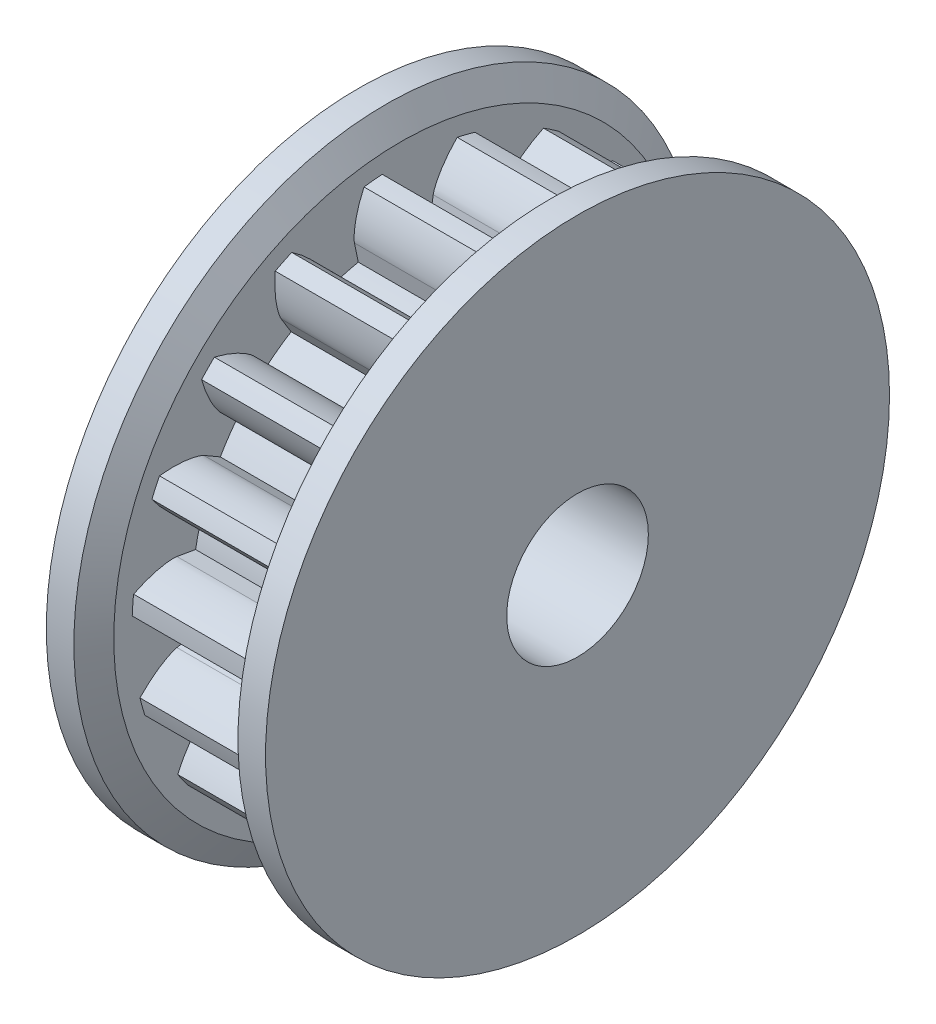
from build123d import *

# Parameters (mm, degrees)
SKETCH1_R                   = 7.957747155
BOSS_EXTRUDE1_DEPTH         = 4
CUT_EXTRUDE1_DEPTH          = 12.943679481
CIRPATTERN6_COUNT           = 18
CIRPATTERN6_COPY_1_DEPTH    = 12.943679481
CIRPATTERN6_COPY_2_DEPTH    = 12.943679481
CIRPATTERN6_COPY_3_DEPTH    = 12.943679481
CIRPATTERN6_COPY_4_DEPTH    = 12.943679481
CIRPATTERN6_COPY_5_DEPTH    = 12.943679481
CIRPATTERN6_COPY_6_DEPTH    = 12.943679481
CIRPATTERN6_COPY_7_DEPTH    = 12.943679481
CIRPATTERN6_COPY_8_DEPTH    = 12.943679481
CIRPATTERN6_COPY_9_DEPTH    = 12.943679481
CIRPATTERN6_COPY_10_DEPTH   = 12.943679481
CIRPATTERN6_COPY_11_DEPTH   = 12.943679481
CIRPATTERN6_COPY_12_DEPTH   = 12.943679481
CIRPATTERN6_COPY_13_DEPTH   = 12.943679481
CIRPATTERN6_COPY_14_DEPTH   = 12.943679481
CIRPATTERN6_COPY_15_DEPTH   = 12.943679481
CIRPATTERN6_COPY_16_DEPTH   = 12.943679481
CIRPATTERN6_COPY_17_DEPTH   = 12.943679481
TAP_DRILL_FOR_M5X0_8_TAP1_D = 4.2


with BuildPart() as part:
    # Sketch1 → Boss-Extrude1 (new body)
    with BuildSketch(Plane.YZ):
        with Locations(Location((0, 0, 0), (0, 0, 270))):
            Circle(SKETCH1_R)
    extrude(amount=BOSS_EXTRUDE1_DEPTH)

    # Sketch3 → Cut-Extrude1 (cut, through all)
    with BuildSketch(Plane.YZ.offset(4)):
        with BuildLine():
            Line((7.143229636, -0.51780265), (6.712440178, -0.486575329))
            Line((6.712440178, -0.486575329), (6.151114409, -0.445885615))
            ThreePointArc((6.151114409, -0.445885615), (6.163217815, -0.223088811), (6.167254045, 0))
            Line((6.167254045, 0), (6.730052651, 0))
            add(Edge.make_bspline(
                [(6.730052651, 0), (6.735028201, 0.000105291), (6.748972525, 0.000726446), (6.77527671, 0.003186858), (6.818021267, 0.009021853), (6.872154257, 0.019121147), (6.9416096, 0.03521433), (7.022648863, 0.058053596), (7.110734403, 0.087182224), (7.205358415, 0.123170438), (7.298569457, 0.162835205), (7.390333265, 0.205857711), (7.480573489, 0.251804665), (7.588384326, 0.311053922), (7.715499791, 0.387065097), (7.860631857, 0.482971281), (8.020934099, 0.599954491), (8.179305123, 0.727671007), (8.330895439, 0.860239842), (8.478803786, 1.001795462), (8.618157696, 1.144139991), (8.757082001, 1.299382167), (8.88238288, 1.446480246), (9.015933814, 1.619048793), (9.121746557, 1.760623063), (9.225109986, 1.913051571), (9.274529275, 1.988136308), (9.299406998, 2.026881066)],
                knots=[0, 0, 0, 0, 0, 0.005376748, 0.015083688, 0.02853182, 0.046610139, 0.064854849, 0.092110525, 0.119476175, 0.146842495, 0.174208853, 0.201574955, 0.228941013, 0.256307345, 0.307035032, 0.361767351, 0.41649966, 0.471231936, 0.525964281, 0.580696615, 0.635428982, 0.690161387, 0.744893688, 0.799626083, 0.854358408, 0.909090916, 0.909090916, 0.909090916, 0.909090916, 0.909090916], degree=4))
            Line((9.299406998, 2.026881066), (9.299406998, -0.674100909))
            Line((9.299406998, -0.674100909), (7.143229636, -0.51780265))
        make_face()
    cut_extrude1 = extrude(amount=-CUT_EXTRUDE1_DEPTH, mode=Mode.SUBTRACT)

    # Mirror1: Cut-Extrude1 across plane
    add(cut_extrude1.mirror(Plane(origin=(0, 7.143229636, -0.51780265), x_dir=(1, 0, 0), z_dir=(0, -0.07229888895007923, -0.9973830110126121))), mode=Mode.SUBTRACT)

    # CirPattern6: Cut-Extrude1 ×18 about axis
    cirpattern6_axis = Axis((4, 0, 0), (-1, 0, 0))
    for i in range(1, CIRPATTERN6_COUNT):
        add(cut_extrude1.rotate(cirpattern6_axis, i * 360 / CIRPATTERN6_COUNT), mode=Mode.SUBTRACT)

    # CirPattern6 copy 1 sketch → CirPattern6 copy 1 (cut, through all)
    with BuildSketch(Plane(origin=(4, 0, 0), x_dir=(0, 0.880542902433561, -0.4739664513168419), z_dir=(1, 0, 0))):
        with BuildLine():
            Line((7.143229636, 0.51780265), (6.712440178, 0.486575329))
            Line((6.712440178, 0.486575329), (6.151114409, 0.445885615))
            ThreePointArc((6.151114409, 0.445885615), (6.163217815, 0.223088811), (6.167254045, 0))
            Line((6.167254045, 0), (6.730052651, 0))
            add(Edge.make_bspline(
                [(6.730052651, 0), (6.735028201, -0.000105291), (6.748972525, -0.000726446), (6.77527671, -0.003186858), (6.818021267, -0.009021853), (6.872154257, -0.019121147), (6.9416096, -0.03521433), (7.022648863, -0.058053596), (7.110734403, -0.087182224), (7.205358415, -0.123170438), (7.298569457, -0.162835205), (7.390333265, -0.205857711), (7.480573489, -0.251804665), (7.588384326, -0.311053922), (7.715499791, -0.387065097), (7.860631857, -0.482971281), (8.020934099, -0.599954491), (8.179305123, -0.727671007), (8.330895439, -0.860239842), (8.478803786, -1.001795462), (8.618157696, -1.144139991), (8.757082001, -1.299382167), (8.88238288, -1.446480246), (9.015933814, -1.619048793), (9.121746557, -1.760623063), (9.225109986, -1.913051571), (9.274529275, -1.988136308), (9.299406998, -2.026881066)],
                knots=[0, 0, 0, 0, 0, 0.005376748, 0.015083688, 0.02853182, 0.046610139, 0.064854849, 0.092110525, 0.119476175, 0.146842495, 0.174208853, 0.201574955, 0.228941013, 0.256307345, 0.307035032, 0.361767351, 0.41649966, 0.471231936, 0.525964281, 0.580696615, 0.635428982, 0.690161387, 0.744893688, 0.799626083, 0.854358408, 0.909090916, 0.909090916, 0.909090916, 0.909090916, 0.909090916], degree=4))
            Line((9.299406998, -2.026881066), (9.299406998, 0.674100909))
            Line((9.299406998, 0.674100909), (7.143229636, 0.51780265))
        make_face()
    extrude(amount=-CIRPATTERN6_COPY_1_DEPTH, mode=Mode.SUBTRACT)

    # CirPattern6 copy 2 sketch → CirPattern6 copy 2 (cut, through all)
    with BuildSketch(Plane(origin=(4, 0, 0), x_dir=(0, 0.6653335940912785, -0.7465461864972467), z_dir=(1, 0, 0))):
        with BuildLine():
            Line((7.143229636, 0.51780265), (6.712440178, 0.486575329))
            Line((6.712440178, 0.486575329), (6.151114409, 0.445885615))
            ThreePointArc((6.151114409, 0.445885615), (6.163217815, 0.223088811), (6.167254045, 0))
            Line((6.167254045, 0), (6.730052651, 0))
            add(Edge.make_bspline(
                [(6.730052651, 0), (6.735028201, -0.000105291), (6.748972525, -0.000726446), (6.77527671, -0.003186858), (6.818021267, -0.009021853), (6.872154257, -0.019121147), (6.9416096, -0.03521433), (7.022648863, -0.058053596), (7.110734403, -0.087182224), (7.205358415, -0.123170438), (7.298569457, -0.162835205), (7.390333265, -0.205857711), (7.480573489, -0.251804665), (7.588384326, -0.311053922), (7.715499791, -0.387065097), (7.860631857, -0.482971281), (8.020934099, -0.599954491), (8.179305123, -0.727671007), (8.330895439, -0.860239842), (8.478803786, -1.001795462), (8.618157696, -1.144139991), (8.757082001, -1.299382167), (8.88238288, -1.446480246), (9.015933814, -1.619048793), (9.121746557, -1.760623063), (9.225109986, -1.913051571), (9.274529275, -1.988136308), (9.299406998, -2.026881066)],
                knots=[0, 0, 0, 0, 0, 0.005376748, 0.015083688, 0.02853182, 0.046610139, 0.064854849, 0.092110525, 0.119476175, 0.146842495, 0.174208853, 0.201574955, 0.228941013, 0.256307345, 0.307035032, 0.361767351, 0.41649966, 0.471231936, 0.525964281, 0.580696615, 0.635428982, 0.690161387, 0.744893688, 0.799626083, 0.854358408, 0.909090916, 0.909090916, 0.909090916, 0.909090916, 0.909090916], degree=4))
            Line((9.299406998, -2.026881066), (9.299406998, 0.674100909))
            Line((9.299406998, 0.674100909), (7.143229636, 0.51780265))
        make_face()
    extrude(amount=-CIRPATTERN6_COPY_2_DEPTH, mode=Mode.SUBTRACT)

    # CirPattern6 copy 3 sketch → CirPattern6 copy 3 (cut, through all)
    with BuildSketch(Plane(origin=(4, 0, 0), x_dir=(0, 0.3698752350235216, -0.9290814337378046), z_dir=(1, 0, 0))):
        with BuildLine():
            Line((7.143229636, 0.51780265), (6.712440178, 0.486575329))
            Line((6.712440178, 0.486575329), (6.151114409, 0.445885615))
            ThreePointArc((6.151114409, 0.445885615), (6.163217815, 0.223088811), (6.167254045, 0))
            Line((6.167254045, 0), (6.730052651, 0))
            add(Edge.make_bspline(
                [(6.730052651, 0), (6.735028201, -0.000105291), (6.748972525, -0.000726446), (6.77527671, -0.003186858), (6.818021267, -0.009021853), (6.872154257, -0.019121147), (6.9416096, -0.03521433), (7.022648863, -0.058053596), (7.110734403, -0.087182224), (7.205358415, -0.123170438), (7.298569457, -0.162835205), (7.390333265, -0.205857711), (7.480573489, -0.251804665), (7.588384326, -0.311053922), (7.715499791, -0.387065097), (7.860631857, -0.482971281), (8.020934099, -0.599954491), (8.179305123, -0.727671007), (8.330895439, -0.860239842), (8.478803786, -1.001795462), (8.618157696, -1.144139991), (8.757082001, -1.299382167), (8.88238288, -1.446480246), (9.015933814, -1.619048793), (9.121746557, -1.760623063), (9.225109986, -1.913051571), (9.274529275, -1.988136308), (9.299406998, -2.026881066)],
                knots=[0, 0, 0, 0, 0, 0.005376748, 0.015083688, 0.02853182, 0.046610139, 0.064854849, 0.092110525, 0.119476175, 0.146842495, 0.174208853, 0.201574955, 0.228941013, 0.256307345, 0.307035032, 0.361767351, 0.41649966, 0.471231936, 0.525964281, 0.580696615, 0.635428982, 0.690161387, 0.744893688, 0.799626083, 0.854358408, 0.909090916, 0.909090916, 0.909090916, 0.909090916, 0.909090916], degree=4))
            Line((9.299406998, -2.026881066), (9.299406998, 0.674100909))
            Line((9.299406998, 0.674100909), (7.143229636, 0.51780265))
        make_face()
    extrude(amount=-CIRPATTERN6_COPY_3_DEPTH, mode=Mode.SUBTRACT)

    # CirPattern6 copy 4 sketch → CirPattern6 copy 4 (cut, through all)
    with BuildSketch(Plane(origin=(4, 0, 0), x_dir=(0, 0.029804463834835065, -0.9995557482879671), z_dir=(1, 0, 0))):
        with BuildLine():
            Line((7.143229636, 0.51780265), (6.712440178, 0.486575329))
            Line((6.712440178, 0.486575329), (6.151114409, 0.445885615))
            ThreePointArc((6.151114409, 0.445885615), (6.163217815, 0.223088811), (6.167254045, 0))
            Line((6.167254045, 0), (6.730052651, 0))
            add(Edge.make_bspline(
                [(6.730052651, 0), (6.735028201, -0.000105291), (6.748972525, -0.000726446), (6.77527671, -0.003186858), (6.818021267, -0.009021853), (6.872154257, -0.019121147), (6.9416096, -0.03521433), (7.022648863, -0.058053596), (7.110734403, -0.087182224), (7.205358415, -0.123170438), (7.298569457, -0.162835205), (7.390333265, -0.205857711), (7.480573489, -0.251804665), (7.588384326, -0.311053922), (7.715499791, -0.387065097), (7.860631857, -0.482971281), (8.020934099, -0.599954491), (8.179305123, -0.727671007), (8.330895439, -0.860239842), (8.478803786, -1.001795462), (8.618157696, -1.144139991), (8.757082001, -1.299382167), (8.88238288, -1.446480246), (9.015933814, -1.619048793), (9.121746557, -1.760623063), (9.225109986, -1.913051571), (9.274529275, -1.988136308), (9.299406998, -2.026881066)],
                knots=[0, 0, 0, 0, 0, 0.005376748, 0.015083688, 0.02853182, 0.046610139, 0.064854849, 0.092110525, 0.119476175, 0.146842495, 0.174208853, 0.201574955, 0.228941013, 0.256307345, 0.307035032, 0.361767351, 0.41649966, 0.471231936, 0.525964281, 0.580696615, 0.635428982, 0.690161387, 0.744893688, 0.799626083, 0.854358408, 0.909090916, 0.909090916, 0.909090916, 0.909090916, 0.909090916], degree=4))
            Line((9.299406998, -2.026881066), (9.299406998, 0.674100909))
            Line((9.299406998, 0.674100909), (7.143229636, 0.51780265))
        make_face()
    extrude(amount=-CIRPATTERN6_COPY_4_DEPTH, mode=Mode.SUBTRACT)

    # CirPattern6 copy 5 sketch → CirPattern6 copy 5 (cut, through all)
    with BuildSketch(Plane(origin=(4, 0, 0), x_dir=(0, -0.3138611655593716, -0.9494688877228745), z_dir=(1, 0, 0))):
        with BuildLine():
            Line((7.143229636, 0.51780265), (6.712440178, 0.486575329))
            Line((6.712440178, 0.486575329), (6.151114409, 0.445885615))
            ThreePointArc((6.151114409, 0.445885615), (6.163217815, 0.223088811), (6.167254045, 0))
            Line((6.167254045, 0), (6.730052651, 0))
            add(Edge.make_bspline(
                [(6.730052651, 0), (6.735028201, -0.000105291), (6.748972525, -0.000726446), (6.77527671, -0.003186858), (6.818021267, -0.009021853), (6.872154257, -0.019121147), (6.9416096, -0.03521433), (7.022648863, -0.058053596), (7.110734403, -0.087182224), (7.205358415, -0.123170438), (7.298569457, -0.162835205), (7.390333265, -0.205857711), (7.480573489, -0.251804665), (7.588384326, -0.311053922), (7.715499791, -0.387065097), (7.860631857, -0.482971281), (8.020934099, -0.599954491), (8.179305123, -0.727671007), (8.330895439, -0.860239842), (8.478803786, -1.001795462), (8.618157696, -1.144139991), (8.757082001, -1.299382167), (8.88238288, -1.446480246), (9.015933814, -1.619048793), (9.121746557, -1.760623063), (9.225109986, -1.913051571), (9.274529275, -1.988136308), (9.299406998, -2.026881066)],
                knots=[0, 0, 0, 0, 0, 0.005376748, 0.015083688, 0.02853182, 0.046610139, 0.064854849, 0.092110525, 0.119476175, 0.146842495, 0.174208853, 0.201574955, 0.228941013, 0.256307345, 0.307035032, 0.361767351, 0.41649966, 0.471231936, 0.525964281, 0.580696615, 0.635428982, 0.690161387, 0.744893688, 0.799626083, 0.854358408, 0.909090916, 0.909090916, 0.909090916, 0.909090916, 0.909090916], degree=4))
            Line((9.299406998, -2.026881066), (9.299406998, 0.674100909))
            Line((9.299406998, 0.674100909), (7.143229636, 0.51780265))
        make_face()
    extrude(amount=-CIRPATTERN6_COPY_5_DEPTH, mode=Mode.SUBTRACT)

    # CirPattern6 copy 6 sketch → CirPattern6 copy 6 (cut, through all)
    with BuildSketch(Plane(origin=(4, 0, 0), x_dir=(0, -0.6196705062896465, -0.7848620666300118), z_dir=(1, 0, 0))):
        with BuildLine():
            Line((7.143229636, 0.51780265), (6.712440178, 0.486575329))
            Line((6.712440178, 0.486575329), (6.151114409, 0.445885615))
            ThreePointArc((6.151114409, 0.445885615), (6.163217815, 0.223088811), (6.167254045, 0))
            Line((6.167254045, 0), (6.730052651, 0))
            add(Edge.make_bspline(
                [(6.730052651, 0), (6.735028201, -0.000105291), (6.748972525, -0.000726446), (6.77527671, -0.003186858), (6.818021267, -0.009021853), (6.872154257, -0.019121147), (6.9416096, -0.03521433), (7.022648863, -0.058053596), (7.110734403, -0.087182224), (7.205358415, -0.123170438), (7.298569457, -0.162835205), (7.390333265, -0.205857711), (7.480573489, -0.251804665), (7.588384326, -0.311053922), (7.715499791, -0.387065097), (7.860631857, -0.482971281), (8.020934099, -0.599954491), (8.179305123, -0.727671007), (8.330895439, -0.860239842), (8.478803786, -1.001795462), (8.618157696, -1.144139991), (8.757082001, -1.299382167), (8.88238288, -1.446480246), (9.015933814, -1.619048793), (9.121746557, -1.760623063), (9.225109986, -1.913051571), (9.274529275, -1.988136308), (9.299406998, -2.026881066)],
                knots=[0, 0, 0, 0, 0, 0.005376748, 0.015083688, 0.02853182, 0.046610139, 0.064854849, 0.092110525, 0.119476175, 0.146842495, 0.174208853, 0.201574955, 0.228941013, 0.256307345, 0.307035032, 0.361767351, 0.41649966, 0.471231936, 0.525964281, 0.580696615, 0.635428982, 0.690161387, 0.744893688, 0.799626083, 0.854358408, 0.909090916, 0.909090916, 0.909090916, 0.909090916, 0.909090916], degree=4))
            Line((9.299406998, -2.026881066), (9.299406998, 0.674100909))
            Line((9.299406998, 0.674100909), (7.143229636, 0.51780265))
        make_face()
    extrude(amount=-CIRPATTERN6_COPY_6_DEPTH, mode=Mode.SUBTRACT)

    # CirPattern6 copy 7 sketch → CirPattern6 copy 7 (cut, through all)
    with BuildSketch(Plane(origin=(4, 0, 0), x_dir=(0, -0.8507384385987259, -0.5255892969711254), z_dir=(1, 0, 0))):
        with BuildLine():
            Line((7.143229636, 0.51780265), (6.712440178, 0.486575329))
            Line((6.712440178, 0.486575329), (6.151114409, 0.445885615))
            ThreePointArc((6.151114409, 0.445885615), (6.163217815, 0.223088811), (6.167254045, 0))
            Line((6.167254045, 0), (6.730052651, 0))
            add(Edge.make_bspline(
                [(6.730052651, 0), (6.735028201, -0.000105291), (6.748972525, -0.000726446), (6.77527671, -0.003186858), (6.818021267, -0.009021853), (6.872154257, -0.019121147), (6.9416096, -0.03521433), (7.022648863, -0.058053596), (7.110734403, -0.087182224), (7.205358415, -0.123170438), (7.298569457, -0.162835205), (7.390333265, -0.205857711), (7.480573489, -0.251804665), (7.588384326, -0.311053922), (7.715499791, -0.387065097), (7.860631857, -0.482971281), (8.020934099, -0.599954491), (8.179305123, -0.727671007), (8.330895439, -0.860239842), (8.478803786, -1.001795462), (8.618157696, -1.144139991), (8.757082001, -1.299382167), (8.88238288, -1.446480246), (9.015933814, -1.619048793), (9.121746557, -1.760623063), (9.225109986, -1.913051571), (9.274529275, -1.988136308), (9.299406998, -2.026881066)],
                knots=[0, 0, 0, 0, 0, 0.005376748, 0.015083688, 0.02853182, 0.046610139, 0.064854849, 0.092110525, 0.119476175, 0.146842495, 0.174208853, 0.201574955, 0.228941013, 0.256307345, 0.307035032, 0.361767351, 0.41649966, 0.471231936, 0.525964281, 0.580696615, 0.635428982, 0.690161387, 0.744893688, 0.799626083, 0.854358408, 0.909090916, 0.909090916, 0.909090916, 0.909090916, 0.909090916], degree=4))
            Line((9.299406998, -2.026881066), (9.299406998, 0.674100909))
            Line((9.299406998, 0.674100909), (7.143229636, 0.51780265))
        make_face()
    extrude(amount=-CIRPATTERN6_COPY_7_DEPTH, mode=Mode.SUBTRACT)

    # CirPattern6 copy 8 sketch → CirPattern6 copy 8 (cut, through all)
    with BuildSketch(Plane(origin=(4, 0, 0), x_dir=(0, -0.9791947596506501, -0.20292270122562803), z_dir=(1, 0, 0))):
        with BuildLine():
            Line((7.143229636, 0.51780265), (6.712440178, 0.486575329))
            Line((6.712440178, 0.486575329), (6.151114409, 0.445885615))
            ThreePointArc((6.151114409, 0.445885615), (6.163217815, 0.223088811), (6.167254045, 0))
            Line((6.167254045, 0), (6.730052651, 0))
            add(Edge.make_bspline(
                [(6.730052651, 0), (6.735028201, -0.000105291), (6.748972525, -0.000726446), (6.77527671, -0.003186858), (6.818021267, -0.009021853), (6.872154257, -0.019121147), (6.9416096, -0.03521433), (7.022648863, -0.058053596), (7.110734403, -0.087182224), (7.205358415, -0.123170438), (7.298569457, -0.162835205), (7.390333265, -0.205857711), (7.480573489, -0.251804665), (7.588384326, -0.311053922), (7.715499791, -0.387065097), (7.860631857, -0.482971281), (8.020934099, -0.599954491), (8.179305123, -0.727671007), (8.330895439, -0.860239842), (8.478803786, -1.001795462), (8.618157696, -1.144139991), (8.757082001, -1.299382167), (8.88238288, -1.446480246), (9.015933814, -1.619048793), (9.121746557, -1.760623063), (9.225109986, -1.913051571), (9.274529275, -1.988136308), (9.299406998, -2.026881066)],
                knots=[0, 0, 0, 0, 0, 0.005376748, 0.015083688, 0.02853182, 0.046610139, 0.064854849, 0.092110525, 0.119476175, 0.146842495, 0.174208853, 0.201574955, 0.228941013, 0.256307345, 0.307035032, 0.361767351, 0.41649966, 0.471231936, 0.525964281, 0.580696615, 0.635428982, 0.690161387, 0.744893688, 0.799626083, 0.854358408, 0.909090916, 0.909090916, 0.909090916, 0.909090916, 0.909090916], degree=4))
            Line((9.299406998, -2.026881066), (9.299406998, 0.674100909))
            Line((9.299406998, 0.674100909), (7.143229636, 0.51780265))
        make_face()
    extrude(amount=-CIRPATTERN6_COPY_8_DEPTH, mode=Mode.SUBTRACT)

    # CirPattern6 copy 9 sketch → CirPattern6 copy 9 (cut, through all)
    with BuildSketch(Plane(origin=(4, 0, 0), x_dir=(0, -0.9895457413131682, 0.14421936710779287), z_dir=(1, 0, 0))):
        with BuildLine():
            Line((7.143229636, 0.51780265), (6.712440178, 0.486575329))
            Line((6.712440178, 0.486575329), (6.151114409, 0.445885615))
            ThreePointArc((6.151114409, 0.445885615), (6.163217815, 0.223088811), (6.167254045, 0))
            Line((6.167254045, 0), (6.730052651, 0))
            add(Edge.make_bspline(
                [(6.730052651, 0), (6.735028201, -0.000105291), (6.748972525, -0.000726446), (6.77527671, -0.003186858), (6.818021267, -0.009021853), (6.872154257, -0.019121147), (6.9416096, -0.03521433), (7.022648863, -0.058053596), (7.110734403, -0.087182224), (7.205358415, -0.123170438), (7.298569457, -0.162835205), (7.390333265, -0.205857711), (7.480573489, -0.251804665), (7.588384326, -0.311053922), (7.715499791, -0.387065097), (7.860631857, -0.482971281), (8.020934099, -0.599954491), (8.179305123, -0.727671007), (8.330895439, -0.860239842), (8.478803786, -1.001795462), (8.618157696, -1.144139991), (8.757082001, -1.299382167), (8.88238288, -1.446480246), (9.015933814, -1.619048793), (9.121746557, -1.760623063), (9.225109986, -1.913051571), (9.274529275, -1.988136308), (9.299406998, -2.026881066)],
                knots=[0, 0, 0, 0, 0, 0.005376748, 0.015083688, 0.02853182, 0.046610139, 0.064854849, 0.092110525, 0.119476175, 0.146842495, 0.174208853, 0.201574955, 0.228941013, 0.256307345, 0.307035032, 0.361767351, 0.41649966, 0.471231936, 0.525964281, 0.580696615, 0.635428982, 0.690161387, 0.744893688, 0.799626083, 0.854358408, 0.909090916, 0.909090916, 0.909090916, 0.909090916, 0.909090916], degree=4))
            Line((9.299406998, -2.026881066), (9.299406998, 0.674100909))
            Line((9.299406998, 0.674100909), (7.143229636, 0.51780265))
        make_face()
    extrude(amount=-CIRPATTERN6_COPY_9_DEPTH, mode=Mode.SUBTRACT)

    # CirPattern6 copy 10 sketch → CirPattern6 copy 10 (cut, through all)
    with BuildSketch(Plane(origin=(4, 0, 0), x_dir=(0, -0.880542902433561, 0.47396645131684184), z_dir=(1, 0, 0))):
        with BuildLine():
            Line((7.143229636, 0.51780265), (6.712440178, 0.486575329))
            Line((6.712440178, 0.486575329), (6.151114409, 0.445885615))
            ThreePointArc((6.151114409, 0.445885615), (6.163217815, 0.223088811), (6.167254045, 0))
            Line((6.167254045, 0), (6.730052651, 0))
            add(Edge.make_bspline(
                [(6.730052651, 0), (6.735028201, -0.000105291), (6.748972525, -0.000726446), (6.77527671, -0.003186858), (6.818021267, -0.009021853), (6.872154257, -0.019121147), (6.9416096, -0.03521433), (7.022648863, -0.058053596), (7.110734403, -0.087182224), (7.205358415, -0.123170438), (7.298569457, -0.162835205), (7.390333265, -0.205857711), (7.480573489, -0.251804665), (7.588384326, -0.311053922), (7.715499791, -0.387065097), (7.860631857, -0.482971281), (8.020934099, -0.599954491), (8.179305123, -0.727671007), (8.330895439, -0.860239842), (8.478803786, -1.001795462), (8.618157696, -1.144139991), (8.757082001, -1.299382167), (8.88238288, -1.446480246), (9.015933814, -1.619048793), (9.121746557, -1.760623063), (9.225109986, -1.913051571), (9.274529275, -1.988136308), (9.299406998, -2.026881066)],
                knots=[0, 0, 0, 0, 0, 0.005376748, 0.015083688, 0.02853182, 0.046610139, 0.064854849, 0.092110525, 0.119476175, 0.146842495, 0.174208853, 0.201574955, 0.228941013, 0.256307345, 0.307035032, 0.361767351, 0.41649966, 0.471231936, 0.525964281, 0.580696615, 0.635428982, 0.690161387, 0.744893688, 0.799626083, 0.854358408, 0.909090916, 0.909090916, 0.909090916, 0.909090916, 0.909090916], degree=4))
            Line((9.299406998, -2.026881066), (9.299406998, 0.674100909))
            Line((9.299406998, 0.674100909), (7.143229636, 0.51780265))
        make_face()
    extrude(amount=-CIRPATTERN6_COPY_10_DEPTH, mode=Mode.SUBTRACT)

    # CirPattern6 copy 11 sketch → CirPattern6 copy 11 (cut, through all)
    with BuildSketch(Plane(origin=(4, 0, 0), x_dir=(0, -0.6653335940912785, 0.7465461864972467), z_dir=(1, 0, 0))):
        with BuildLine():
            Line((7.143229636, 0.51780265), (6.712440178, 0.486575329))
            Line((6.712440178, 0.486575329), (6.151114409, 0.445885615))
            ThreePointArc((6.151114409, 0.445885615), (6.163217815, 0.223088811), (6.167254045, 0))
            Line((6.167254045, 0), (6.730052651, 0))
            add(Edge.make_bspline(
                [(6.730052651, 0), (6.735028201, -0.000105291), (6.748972525, -0.000726446), (6.77527671, -0.003186858), (6.818021267, -0.009021853), (6.872154257, -0.019121147), (6.9416096, -0.03521433), (7.022648863, -0.058053596), (7.110734403, -0.087182224), (7.205358415, -0.123170438), (7.298569457, -0.162835205), (7.390333265, -0.205857711), (7.480573489, -0.251804665), (7.588384326, -0.311053922), (7.715499791, -0.387065097), (7.860631857, -0.482971281), (8.020934099, -0.599954491), (8.179305123, -0.727671007), (8.330895439, -0.860239842), (8.478803786, -1.001795462), (8.618157696, -1.144139991), (8.757082001, -1.299382167), (8.88238288, -1.446480246), (9.015933814, -1.619048793), (9.121746557, -1.760623063), (9.225109986, -1.913051571), (9.274529275, -1.988136308), (9.299406998, -2.026881066)],
                knots=[0, 0, 0, 0, 0, 0.005376748, 0.015083688, 0.02853182, 0.046610139, 0.064854849, 0.092110525, 0.119476175, 0.146842495, 0.174208853, 0.201574955, 0.228941013, 0.256307345, 0.307035032, 0.361767351, 0.41649966, 0.471231936, 0.525964281, 0.580696615, 0.635428982, 0.690161387, 0.744893688, 0.799626083, 0.854358408, 0.909090916, 0.909090916, 0.909090916, 0.909090916, 0.909090916], degree=4))
            Line((9.299406998, -2.026881066), (9.299406998, 0.674100909))
            Line((9.299406998, 0.674100909), (7.143229636, 0.51780265))
        make_face()
    extrude(amount=-CIRPATTERN6_COPY_11_DEPTH, mode=Mode.SUBTRACT)

    # CirPattern6 copy 12 sketch → CirPattern6 copy 12 (cut, through all)
    with BuildSketch(Plane(origin=(4, 0, 0), x_dir=(0, -0.369875235023522, 0.9290814337378045), z_dir=(1, 0, 0))):
        with BuildLine():
            Line((7.143229636, 0.51780265), (6.712440178, 0.486575329))
            Line((6.712440178, 0.486575329), (6.151114409, 0.445885615))
            ThreePointArc((6.151114409, 0.445885615), (6.163217815, 0.223088811), (6.167254045, 0))
            Line((6.167254045, 0), (6.730052651, 0))
            add(Edge.make_bspline(
                [(6.730052651, 0), (6.735028201, -0.000105291), (6.748972525, -0.000726446), (6.77527671, -0.003186858), (6.818021267, -0.009021853), (6.872154257, -0.019121147), (6.9416096, -0.03521433), (7.022648863, -0.058053596), (7.110734403, -0.087182224), (7.205358415, -0.123170438), (7.298569457, -0.162835205), (7.390333265, -0.205857711), (7.480573489, -0.251804665), (7.588384326, -0.311053922), (7.715499791, -0.387065097), (7.860631857, -0.482971281), (8.020934099, -0.599954491), (8.179305123, -0.727671007), (8.330895439, -0.860239842), (8.478803786, -1.001795462), (8.618157696, -1.144139991), (8.757082001, -1.299382167), (8.88238288, -1.446480246), (9.015933814, -1.619048793), (9.121746557, -1.760623063), (9.225109986, -1.913051571), (9.274529275, -1.988136308), (9.299406998, -2.026881066)],
                knots=[0, 0, 0, 0, 0, 0.005376748, 0.015083688, 0.02853182, 0.046610139, 0.064854849, 0.092110525, 0.119476175, 0.146842495, 0.174208853, 0.201574955, 0.228941013, 0.256307345, 0.307035032, 0.361767351, 0.41649966, 0.471231936, 0.525964281, 0.580696615, 0.635428982, 0.690161387, 0.744893688, 0.799626083, 0.854358408, 0.909090916, 0.909090916, 0.909090916, 0.909090916, 0.909090916], degree=4))
            Line((9.299406998, -2.026881066), (9.299406998, 0.674100909))
            Line((9.299406998, 0.674100909), (7.143229636, 0.51780265))
        make_face()
    extrude(amount=-CIRPATTERN6_COPY_12_DEPTH, mode=Mode.SUBTRACT)

    # CirPattern6 copy 13 sketch → CirPattern6 copy 13 (cut, through all)
    with BuildSketch(Plane(origin=(4, 0, 0), x_dir=(0, -0.029804463834834982, 0.9995557482879671), z_dir=(1, 0, 0))):
        with BuildLine():
            Line((7.143229636, 0.51780265), (6.712440178, 0.486575329))
            Line((6.712440178, 0.486575329), (6.151114409, 0.445885615))
            ThreePointArc((6.151114409, 0.445885615), (6.163217815, 0.223088811), (6.167254045, 0))
            Line((6.167254045, 0), (6.730052651, 0))
            add(Edge.make_bspline(
                [(6.730052651, 0), (6.735028201, -0.000105291), (6.748972525, -0.000726446), (6.77527671, -0.003186858), (6.818021267, -0.009021853), (6.872154257, -0.019121147), (6.9416096, -0.03521433), (7.022648863, -0.058053596), (7.110734403, -0.087182224), (7.205358415, -0.123170438), (7.298569457, -0.162835205), (7.390333265, -0.205857711), (7.480573489, -0.251804665), (7.588384326, -0.311053922), (7.715499791, -0.387065097), (7.860631857, -0.482971281), (8.020934099, -0.599954491), (8.179305123, -0.727671007), (8.330895439, -0.860239842), (8.478803786, -1.001795462), (8.618157696, -1.144139991), (8.757082001, -1.299382167), (8.88238288, -1.446480246), (9.015933814, -1.619048793), (9.121746557, -1.760623063), (9.225109986, -1.913051571), (9.274529275, -1.988136308), (9.299406998, -2.026881066)],
                knots=[0, 0, 0, 0, 0, 0.005376748, 0.015083688, 0.02853182, 0.046610139, 0.064854849, 0.092110525, 0.119476175, 0.146842495, 0.174208853, 0.201574955, 0.228941013, 0.256307345, 0.307035032, 0.361767351, 0.41649966, 0.471231936, 0.525964281, 0.580696615, 0.635428982, 0.690161387, 0.744893688, 0.799626083, 0.854358408, 0.909090916, 0.909090916, 0.909090916, 0.909090916, 0.909090916], degree=4))
            Line((9.299406998, -2.026881066), (9.299406998, 0.674100909))
            Line((9.299406998, 0.674100909), (7.143229636, 0.51780265))
        make_face()
    extrude(amount=-CIRPATTERN6_COPY_13_DEPTH, mode=Mode.SUBTRACT)

    # CirPattern6 copy 14 sketch → CirPattern6 copy 14 (cut, through all)
    with BuildSketch(Plane(origin=(4, 0, 0), x_dir=(0, 0.3138611655593713, 0.9494688877228747), z_dir=(1, 0, 0))):
        with BuildLine():
            Line((7.143229636, 0.51780265), (6.712440178, 0.486575329))
            Line((6.712440178, 0.486575329), (6.151114409, 0.445885615))
            ThreePointArc((6.151114409, 0.445885615), (6.163217815, 0.223088811), (6.167254045, 0))
            Line((6.167254045, 0), (6.730052651, 0))
            add(Edge.make_bspline(
                [(6.730052651, 0), (6.735028201, -0.000105291), (6.748972525, -0.000726446), (6.77527671, -0.003186858), (6.818021267, -0.009021853), (6.872154257, -0.019121147), (6.9416096, -0.03521433), (7.022648863, -0.058053596), (7.110734403, -0.087182224), (7.205358415, -0.123170438), (7.298569457, -0.162835205), (7.390333265, -0.205857711), (7.480573489, -0.251804665), (7.588384326, -0.311053922), (7.715499791, -0.387065097), (7.860631857, -0.482971281), (8.020934099, -0.599954491), (8.179305123, -0.727671007), (8.330895439, -0.860239842), (8.478803786, -1.001795462), (8.618157696, -1.144139991), (8.757082001, -1.299382167), (8.88238288, -1.446480246), (9.015933814, -1.619048793), (9.121746557, -1.760623063), (9.225109986, -1.913051571), (9.274529275, -1.988136308), (9.299406998, -2.026881066)],
                knots=[0, 0, 0, 0, 0, 0.005376748, 0.015083688, 0.02853182, 0.046610139, 0.064854849, 0.092110525, 0.119476175, 0.146842495, 0.174208853, 0.201574955, 0.228941013, 0.256307345, 0.307035032, 0.361767351, 0.41649966, 0.471231936, 0.525964281, 0.580696615, 0.635428982, 0.690161387, 0.744893688, 0.799626083, 0.854358408, 0.909090916, 0.909090916, 0.909090916, 0.909090916, 0.909090916], degree=4))
            Line((9.299406998, -2.026881066), (9.299406998, 0.674100909))
            Line((9.299406998, 0.674100909), (7.143229636, 0.51780265))
        make_face()
    extrude(amount=-CIRPATTERN6_COPY_14_DEPTH, mode=Mode.SUBTRACT)

    # CirPattern6 copy 15 sketch → CirPattern6 copy 15 (cut, through all)
    with BuildSketch(Plane(origin=(4, 0, 0), x_dir=(0, 0.6196705062896468, 0.7848620666300117), z_dir=(1, 0, 0))):
        with BuildLine():
            Line((7.143229636, 0.51780265), (6.712440178, 0.486575329))
            Line((6.712440178, 0.486575329), (6.151114409, 0.445885615))
            ThreePointArc((6.151114409, 0.445885615), (6.163217815, 0.223088811), (6.167254045, 0))
            Line((6.167254045, 0), (6.730052651, 0))
            add(Edge.make_bspline(
                [(6.730052651, 0), (6.735028201, -0.000105291), (6.748972525, -0.000726446), (6.77527671, -0.003186858), (6.818021267, -0.009021853), (6.872154257, -0.019121147), (6.9416096, -0.03521433), (7.022648863, -0.058053596), (7.110734403, -0.087182224), (7.205358415, -0.123170438), (7.298569457, -0.162835205), (7.390333265, -0.205857711), (7.480573489, -0.251804665), (7.588384326, -0.311053922), (7.715499791, -0.387065097), (7.860631857, -0.482971281), (8.020934099, -0.599954491), (8.179305123, -0.727671007), (8.330895439, -0.860239842), (8.478803786, -1.001795462), (8.618157696, -1.144139991), (8.757082001, -1.299382167), (8.88238288, -1.446480246), (9.015933814, -1.619048793), (9.121746557, -1.760623063), (9.225109986, -1.913051571), (9.274529275, -1.988136308), (9.299406998, -2.026881066)],
                knots=[0, 0, 0, 0, 0, 0.005376748, 0.015083688, 0.02853182, 0.046610139, 0.064854849, 0.092110525, 0.119476175, 0.146842495, 0.174208853, 0.201574955, 0.228941013, 0.256307345, 0.307035032, 0.361767351, 0.41649966, 0.471231936, 0.525964281, 0.580696615, 0.635428982, 0.690161387, 0.744893688, 0.799626083, 0.854358408, 0.909090916, 0.909090916, 0.909090916, 0.909090916, 0.909090916], degree=4))
            Line((9.299406998, -2.026881066), (9.299406998, 0.674100909))
            Line((9.299406998, 0.674100909), (7.143229636, 0.51780265))
        make_face()
    extrude(amount=-CIRPATTERN6_COPY_15_DEPTH, mode=Mode.SUBTRACT)

    # CirPattern6 copy 16 sketch → CirPattern6 copy 16 (cut, through all)
    with BuildSketch(Plane(origin=(4, 0, 0), x_dir=(0, 0.8507384385987258, 0.5255892969711256), z_dir=(1, 0, 0))):
        with BuildLine():
            Line((7.143229636, 0.51780265), (6.712440178, 0.486575329))
            Line((6.712440178, 0.486575329), (6.151114409, 0.445885615))
            ThreePointArc((6.151114409, 0.445885615), (6.163217815, 0.223088811), (6.167254045, 0))
            Line((6.167254045, 0), (6.730052651, 0))
            add(Edge.make_bspline(
                [(6.730052651, 0), (6.735028201, -0.000105291), (6.748972525, -0.000726446), (6.77527671, -0.003186858), (6.818021267, -0.009021853), (6.872154257, -0.019121147), (6.9416096, -0.03521433), (7.022648863, -0.058053596), (7.110734403, -0.087182224), (7.205358415, -0.123170438), (7.298569457, -0.162835205), (7.390333265, -0.205857711), (7.480573489, -0.251804665), (7.588384326, -0.311053922), (7.715499791, -0.387065097), (7.860631857, -0.482971281), (8.020934099, -0.599954491), (8.179305123, -0.727671007), (8.330895439, -0.860239842), (8.478803786, -1.001795462), (8.618157696, -1.144139991), (8.757082001, -1.299382167), (8.88238288, -1.446480246), (9.015933814, -1.619048793), (9.121746557, -1.760623063), (9.225109986, -1.913051571), (9.274529275, -1.988136308), (9.299406998, -2.026881066)],
                knots=[0, 0, 0, 0, 0, 0.005376748, 0.015083688, 0.02853182, 0.046610139, 0.064854849, 0.092110525, 0.119476175, 0.146842495, 0.174208853, 0.201574955, 0.228941013, 0.256307345, 0.307035032, 0.361767351, 0.41649966, 0.471231936, 0.525964281, 0.580696615, 0.635428982, 0.690161387, 0.744893688, 0.799626083, 0.854358408, 0.909090916, 0.909090916, 0.909090916, 0.909090916, 0.909090916], degree=4))
            Line((9.299406998, -2.026881066), (9.299406998, 0.674100909))
            Line((9.299406998, 0.674100909), (7.143229636, 0.51780265))
        make_face()
    extrude(amount=-CIRPATTERN6_COPY_16_DEPTH, mode=Mode.SUBTRACT)

    # CirPattern6 copy 17 sketch → CirPattern6 copy 17 (cut, through all)
    with BuildSketch(Plane(origin=(4, 0, 0), x_dir=(0, 0.9791947596506502, 0.20292270122562772), z_dir=(1, 0, 0))):
        with BuildLine():
            Line((7.143229636, 0.51780265), (6.712440178, 0.486575329))
            Line((6.712440178, 0.486575329), (6.151114409, 0.445885615))
            ThreePointArc((6.151114409, 0.445885615), (6.163217815, 0.223088811), (6.167254045, 0))
            Line((6.167254045, 0), (6.730052651, 0))
            add(Edge.make_bspline(
                [(6.730052651, 0), (6.735028201, -0.000105291), (6.748972525, -0.000726446), (6.77527671, -0.003186858), (6.818021267, -0.009021853), (6.872154257, -0.019121147), (6.9416096, -0.03521433), (7.022648863, -0.058053596), (7.110734403, -0.087182224), (7.205358415, -0.123170438), (7.298569457, -0.162835205), (7.390333265, -0.205857711), (7.480573489, -0.251804665), (7.588384326, -0.311053922), (7.715499791, -0.387065097), (7.860631857, -0.482971281), (8.020934099, -0.599954491), (8.179305123, -0.727671007), (8.330895439, -0.860239842), (8.478803786, -1.001795462), (8.618157696, -1.144139991), (8.757082001, -1.299382167), (8.88238288, -1.446480246), (9.015933814, -1.619048793), (9.121746557, -1.760623063), (9.225109986, -1.913051571), (9.274529275, -1.988136308), (9.299406998, -2.026881066)],
                knots=[0, 0, 0, 0, 0, 0.005376748, 0.015083688, 0.02853182, 0.046610139, 0.064854849, 0.092110525, 0.119476175, 0.146842495, 0.174208853, 0.201574955, 0.228941013, 0.256307345, 0.307035032, 0.361767351, 0.41649966, 0.471231936, 0.525964281, 0.580696615, 0.635428982, 0.690161387, 0.744893688, 0.799626083, 0.854358408, 0.909090916, 0.909090916, 0.909090916, 0.909090916, 0.909090916], degree=4))
            Line((9.299406998, -2.026881066), (9.299406998, 0.674100909))
            Line((9.299406998, 0.674100909), (7.143229636, 0.51780265))
        make_face()
    extrude(amount=-CIRPATTERN6_COPY_17_DEPTH, mode=Mode.SUBTRACT)

    # Sketch4 → Revolve1 (revolve)
    with BuildSketch(Plane(origin=(0, 0, 0), x_dir=(-1, 0, 0), z_dir=(0, 1, 0)), mode=Mode.PRIVATE) as revolve1_sk:
        Polygon((-4, 0), (-4, 8.5), (-4.433012702, 9.25), (-5.25, 9.25), (-5.25, 0), align=None)
        Polygon((0, 0), (1.25, 0), (1.25, 9.25), (0.433012702, 9.25), (0, 8.5), align=None)
    revolve(revolve1_sk.sketch.rotate(Axis((9.291003126, 0, 0), (-1, 0, 0)), 180), axis=Axis((9.291003126, 0, 0), (-1, 0, 0)))

    # Tap Drill for M5x0.8 Tap1 (through all)
    with Locations(Plane(origin=(5.25, 0, 0), x_dir=(0, 0, -1), z_dir=(1, 0, 0))):
        with Locations((0, 0)):
            Hole(TAP_DRILL_FOR_M5X0_8_TAP1_D / 2)


solid = part.part
